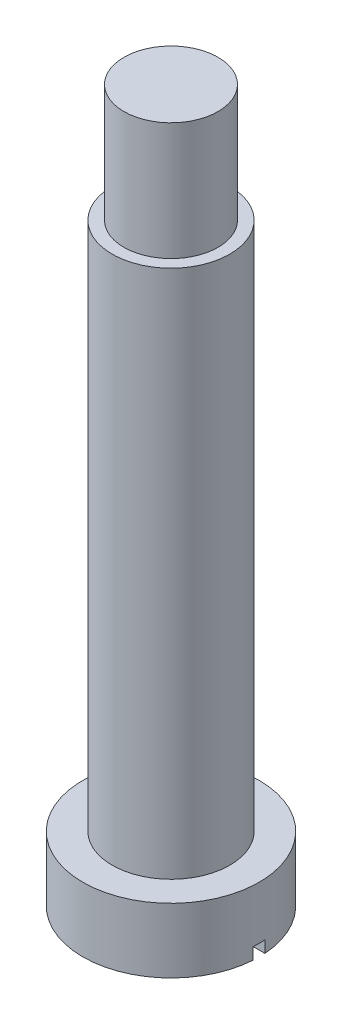
from build123d import *

# Parameters (mm, degrees)
SKETCH_1_R               = 7.5
EXTRUDE_1_DEPTH          = 5.5
SKETCH_2_R               = 5
EXTRUDE_2_DEPTH          = 45
SKETCH_3_R               = 4
EXTRUDE_3_DEPTH          = 10
CUT_EXTRUDE_1_DEPTH      = 62.422715668
CUT_EXTRUDE_1_DEPTH_BACK = 1
SKETCH_4_W               = 15
SKETCH_4_H               = 1


with BuildPart() as part:
    # 草图1 → 凸台-拉伸1 (new body)
    with BuildSketch(Plane(origin=(0, 0, 0), x_dir=(1, 0, 0), z_dir=(0, 1, 0))):
        Circle(SKETCH_1_R)
    extrude(amount=-EXTRUDE_1_DEPTH)

    # 草图2 → 凸台-拉伸2 (add)
    with BuildSketch(Plane(origin=(0, 0, 0), x_dir=(1, 0, 0), z_dir=(0, 1, 0))):
        Circle(SKETCH_2_R)
    extrude(amount=EXTRUDE_2_DEPTH)

    # 草图3 → 凸台-拉伸3 (add)
    with BuildSketch(Plane(origin=(0, 45, 0), x_dir=(1, 0, 0), z_dir=(0, 1, 0))):
        Circle(SKETCH_3_R)
    extrude(amount=EXTRUDE_3_DEPTH)

    # 草图4 → 切除-拉伸-薄壁1 (cut, two sides: drawn at the far end of the back side and taken through both)
    with BuildSketch(Plane.XZ.offset(5.5).offset(-CUT_EXTRUDE_1_DEPTH_BACK)):
        Rectangle(SKETCH_4_W, SKETCH_4_H)
    extrude(amount=CUT_EXTRUDE_1_DEPTH + CUT_EXTRUDE_1_DEPTH_BACK, mode=Mode.SUBTRACT)


solid = part.part
